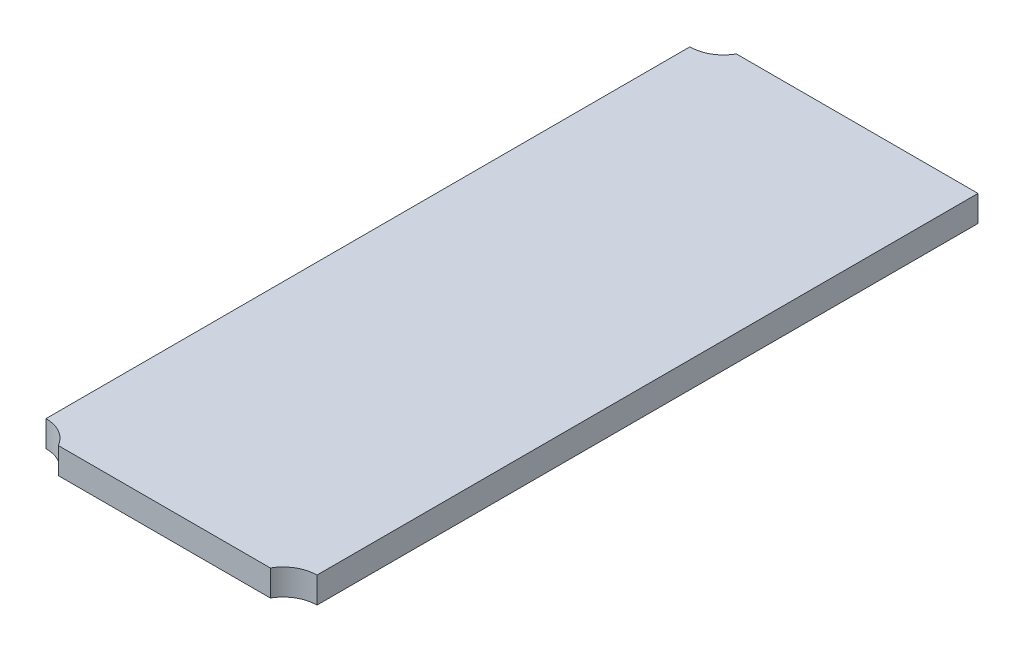
from build123d import *

# Parameters (mm, degrees)
SKETCH_1_W          = 32
SKETCH_1_H          = 103
SKETCH_1_R          = 1.6
EXTRUDE_1_DEPTH     = 2.5
SKETCH_2_W          = 32
SKETCH_2_H          = 103
CUT_EXTRUDE_1_DEPTH = 108.885355818


with BuildPart() as part:
    # 草图1 → 凸台-拉伸1 (new body)
    with BuildSketch(Plane(origin=(0, 0, 0), x_dir=(1, 0, 0), z_dir=(0, 1, 0))):
        with Locations((16, 51.5)):
            Rectangle(SKETCH_1_W, SKETCH_1_H)
        with Locations(Location((3, 3, 0), (0, 0, 270))):
            Circle(SKETCH_1_R, mode=Mode.SUBTRACT)
        with Locations(Location((29, 3, 0), (0, 0, 270))):
            Circle(SKETCH_1_R, mode=Mode.SUBTRACT)
        with Locations(Location((3, 71.27, 0), (0, 0, 270))):
            Circle(SKETCH_1_R, mode=Mode.SUBTRACT)
        with Locations(Location((29, 100.07, 0), (0, 0, 270))):
            Circle(SKETCH_1_R, mode=Mode.SUBTRACT)
    extrude(amount=EXTRUDE_1_DEPTH)

    # 草图2 → 切除-拉伸1 (cut, through all)
    with BuildSketch(Plane(origin=(0, 2.5, 0), x_dir=(1, 0, 0), z_dir=(0, 1, 0))):
        with Locations((16, 51.5)):
            Rectangle(SKETCH_2_W, SKETCH_2_H)
        with BuildLine():
            Line((3, 68.02), (3, 6.25))
            ThreePointArc((3, 6.25), (4.637452289, 5.807356408), (5.828869032, 4.6))
            Line((5.828869032, 4.6), (26.171130968, 4.6))
            ThreePointArc((26.171130968, 4.6), (27.362547711, 5.807356408), (29, 6.25))
            Line((29, 6.25), (29, 69.67))
            Line((29, 69.67), (5.828869032, 69.67))
            ThreePointArc((5.828869032, 69.67), (4.637452289, 68.462643592), (3, 68.02))
        make_face(mode=Mode.SUBTRACT)
    extrude(amount=-CUT_EXTRUDE_1_DEPTH, mode=Mode.SUBTRACT)


solid = part.part
